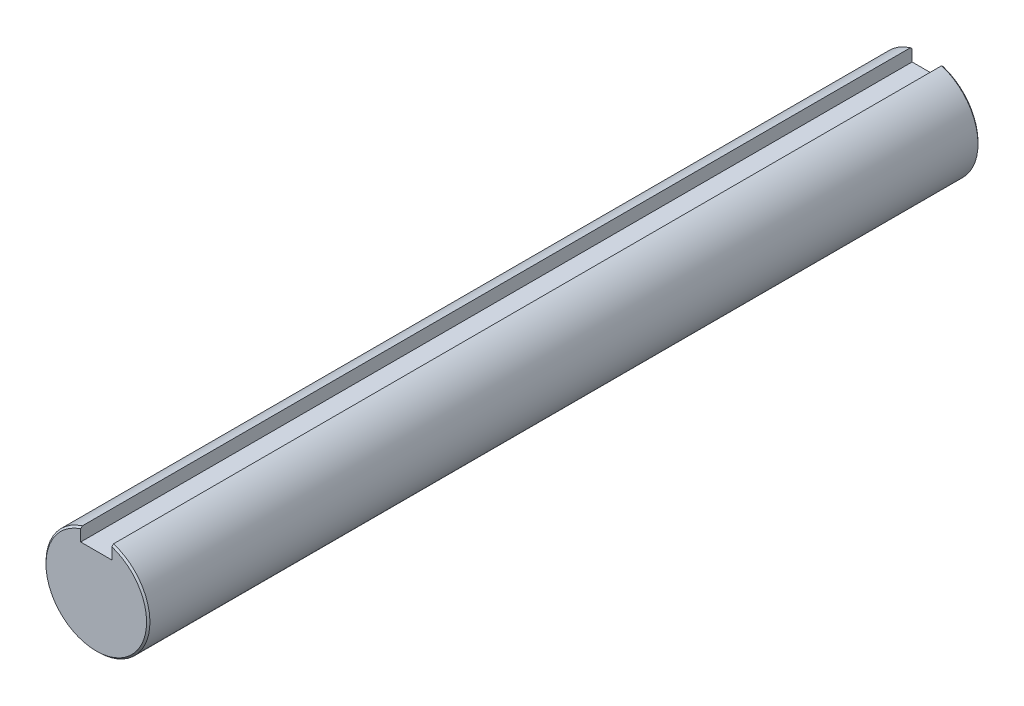
from build123d import *

# Parameters (mm, degrees)
BOSS_EXTRUDE1_DEPTH = 127
CHAMFER1_SIZE       = 0.254


with BuildPart() as part:
    # Sketch1 → Boss-Extrude1 (new body)
    with BuildSketch(Plane.XY):
        with BuildLine():
            Line((2.38125, 5.55625), (-2.38125, 5.55625))
            Line((-2.38125, 5.55625), (-2.38125, 7.571892411))
            ThreePointArc((-2.38125, 7.571892411), (-4.695888328, -6.399417088), (7.9375, 0))
            ThreePointArc((7.9375, 0), (6.399417088, 4.695888328), (2.38125, 7.571892411))
            Line((2.38125, 7.571892411), (2.38125, 5.55625))
        make_face()
    extrude(amount=BOSS_EXTRUDE1_DEPTH)

    # Chamfer1
    chamfer1_edges = [part.edges().sort_by_distance(p)[0] for p in [
        (0, -7.9375, 0),
        (0, -7.9375, 127),
    ]]
    chamfer(chamfer1_edges, length=CHAMFER1_SIZE)


solid = part.part
